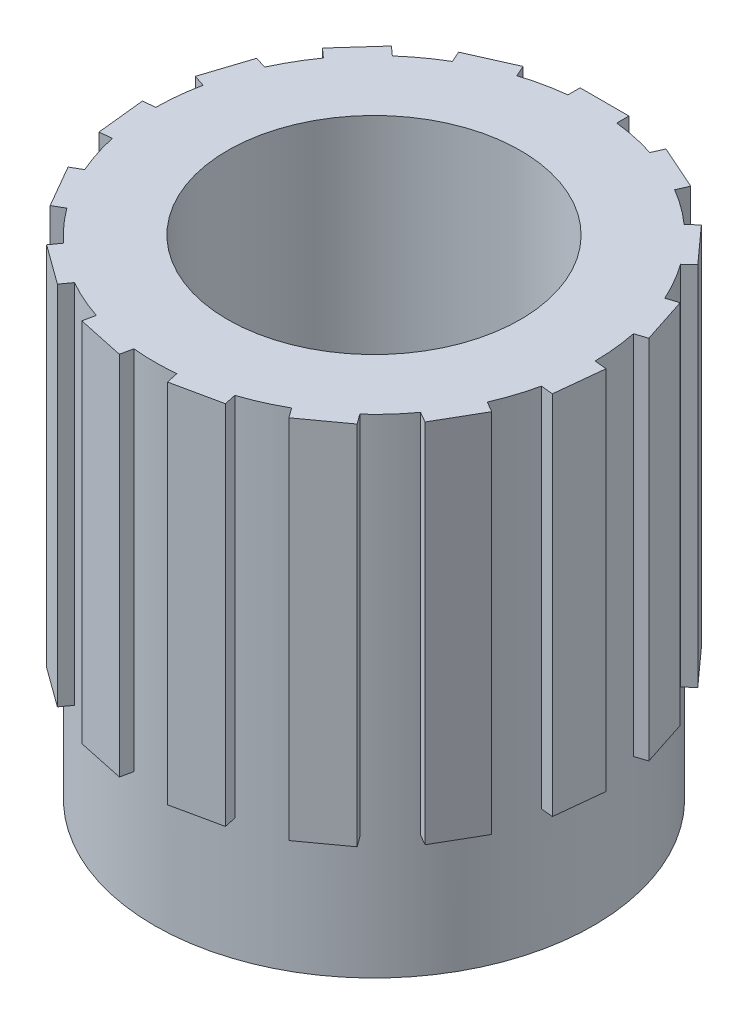
from build123d import *

# Parameters (mm, degrees)
SKETCH1_R            = 1.8
BODY_DEPTH           = 4
TEETH_START          = -3
TEETH_DEPTH          = 3
CIRPATTERN1_COUNT    = 15
M2_CLEARANCE_HOLE1_D = 2.4


with BuildPart() as part:
    # Sketch1 → Body (new body)
    with BuildSketch(Plane(origin=(0, 0, 0), x_dir=(1, 0, 0), z_dir=(0, 1, 0))):
        with Locations(Location((0, 0, 0), (0, 0, 270))):
            Circle(SKETCH1_R)
    extrude(amount=BODY_DEPTH)

    # Sketch2 → Teeth (add)
    with BuildSketch(Plane(origin=(0, 4, 0), x_dir=(1, 0, 0), z_dir=(0, 1, 0)).offset(TEETH_START)):
        with BuildLine():
            Line((-0.2, 1.788854382), (-0.2, 1.888854382))
            Line((-0.2, 1.888854382), (0.2, 1.888854382))
            Line((0.2, 1.888854382), (0.2, 1.788854382))
            ThreePointArc((0.2, 1.788854382), (0, 1.8), (-0.2, 1.788854382))
        make_face()
    teeth = extrude(amount=TEETH_DEPTH)

    # CirPattern1: Teeth ×15 about axis
    cirpattern1_axis = Axis((0, 0, 0), (0, 1, 0))
    for i in range(1, CIRPATTERN1_COUNT):
        add(teeth.rotate(cirpattern1_axis, i * 360 / CIRPATTERN1_COUNT))

    # M2 Clearance Hole1 (through all)
    with Locations(Plane(origin=(0, 4, 0), x_dir=(1, 0, 0), z_dir=(0, 1, 0))):
        with Locations((0, 0)):
            Hole(M2_CLEARANCE_HOLE1_D / 2)


solid = part.part
